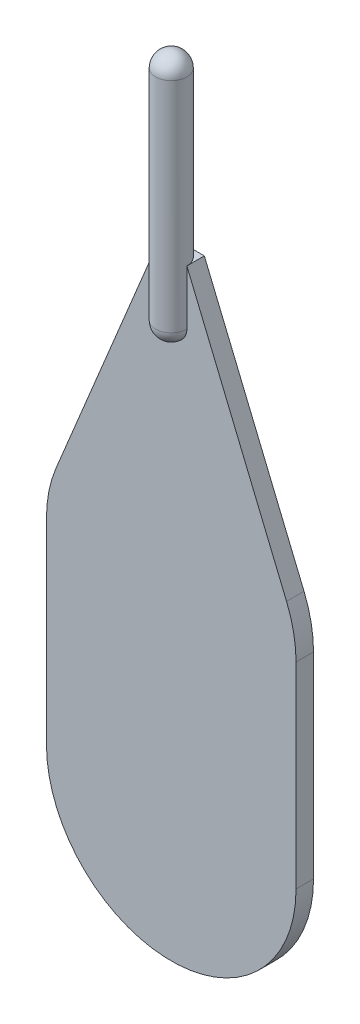
from build123d import *

# Parameters (mm, degrees)
BOSS_EXTRUDE1_DEPTH = 0.889


with BuildPart() as part:
    # Sketch1 → Boss-Extrude1 (new body)
    with BuildSketch(Plane.XY):
        with BuildLine():
            Line((28.389672555, 3.075908507), (28.389672555, 13.075908507))
            ThreePointArc((28.389672555, 13.075908507), (28.267659086, 14.314732052), (27.906307587, 15.505948303))
            Line((27.906307587, 15.505948303), (22.833422555, 27.752976146))
            Line((22.833422555, 27.752976146), (21.245922555, 27.752976146))
            Line((21.245922555, 27.752976146), (16.173037524, 15.505948303))
            ThreePointArc((16.173037524, 15.505948303), (15.811686025, 14.314732052), (15.689672555, 13.075908507))
            Line((15.689672555, 13.075908507), (15.689672555, 3.075908507))
            ThreePointArc((15.689672555, 3.075908507), (22.039672555, -3.274091493), (28.389672555, 3.075908507))
        make_face()
    extrude(amount=BOSS_EXTRUDE1_DEPTH)

    # Sketch2 → Revolve1 (revolve)
    with BuildSketch(Plane.XY.offset(0.889), mode=Mode.PRIVATE) as revolve1_sk:
        with BuildLine():
            Line((22.039672555, 24.173793785), (22.039672555, 36.873793785))
            ThreePointArc((22.039672555, 36.873793785), (21.478406548, 36.641309793), (21.245922555, 36.080043785))
            Line((21.245922555, 36.080043785), (21.245922555, 24.967543785))
            ThreePointArc((21.245922555, 24.967543785), (21.478406548, 24.406277778), (22.039672555, 24.173793785))
        make_face()
    revolve(revolve1_sk.sketch.rotate(Axis((22.039672555, 24.173793785, 0.889), (0, 1, 0)), 270), axis=Axis((22.039672555, 24.173793785, 0.889), (0, 1, 0)))


solid = part.part
